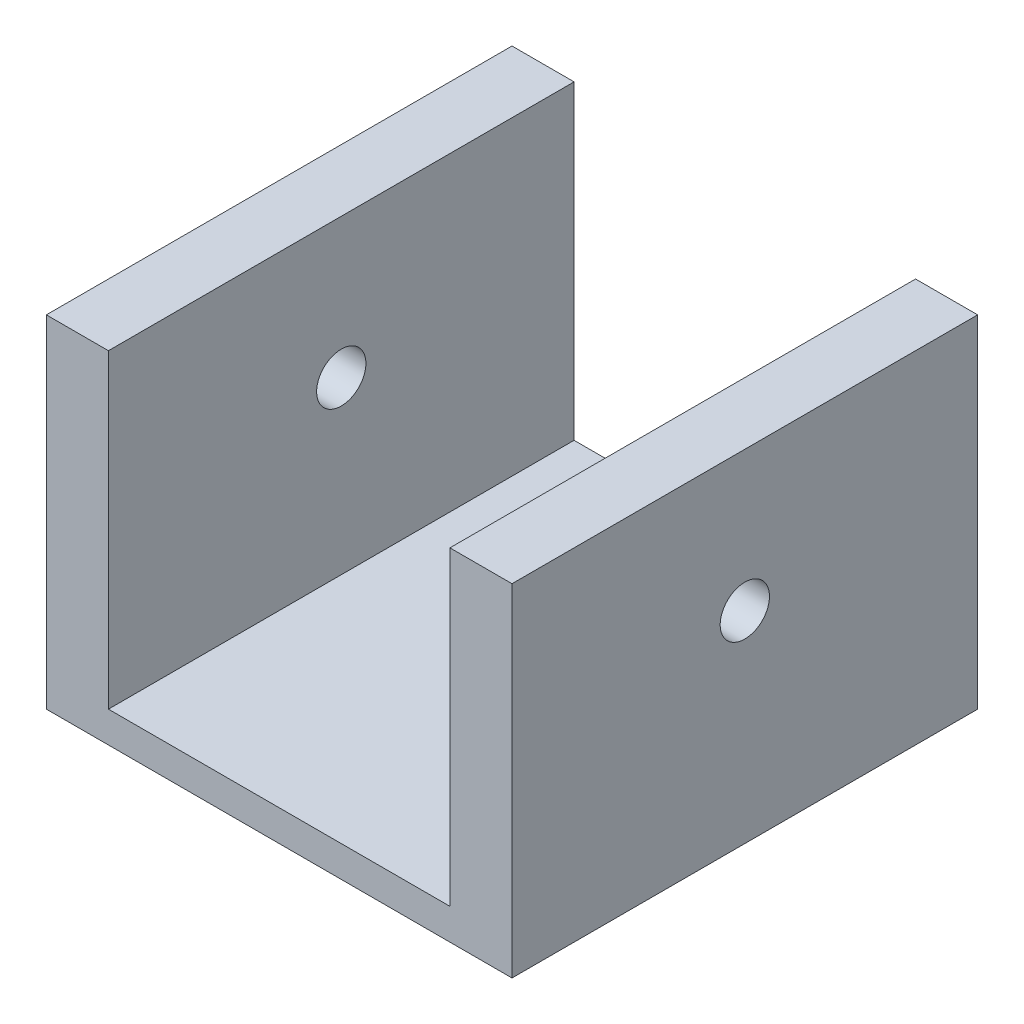
from build123d import *

# Parameters (mm, degrees)
SKETCH1_W           = 150
SKETCH1_H           = 150
BOSS_EXTRUDE1_DEPTH = 10
SKETCH2_W           = 20
SKETCH2_H           = 150
BOSS_EXTRUDE2_DEPTH = 100
SKETCH3_R           = 7.9375
CUT_EXTRUDE1_DEPTH  = 201.561711201


with BuildPart() as part:
    # Sketch1 → Boss-Extrude1 (new body)
    with BuildSketch(Plane(origin=(0, 0, 0), x_dir=(1, 0, 0), z_dir=(0, 1, 0))):
        Rectangle(SKETCH1_W, SKETCH1_H)
    extrude(amount=BOSS_EXTRUDE1_DEPTH)

    # Sketch2 → Boss-Extrude2 (add)
    with BuildSketch(Plane(origin=(0, 10, 0), x_dir=(1, 0, 0), z_dir=(0, 1, 0))):
        with Locations((-65, 0)):
            Rectangle(SKETCH2_W, SKETCH2_H)
        with Locations((65, 0)):
            Rectangle(SKETCH2_W, SKETCH2_H)
    extrude(amount=BOSS_EXTRUDE2_DEPTH)

    # Sketch3 → Cut-Extrude1 (cut, through all)
    with BuildSketch(Plane(origin=(75, 0, 0), x_dir=(0, 0, -1), z_dir=(1, 0, 0))):
        with Locations((0, 65)):
            Circle(SKETCH3_R)
    extrude(amount=-CUT_EXTRUDE1_DEPTH, mode=Mode.SUBTRACT)


solid = part.part
